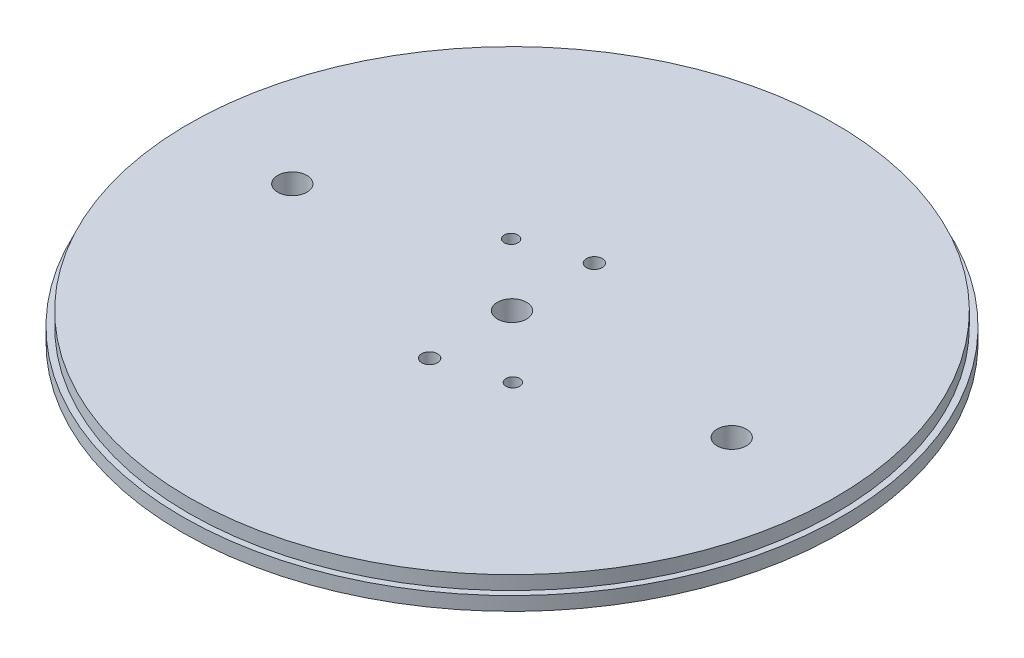
from build123d import *

# Parameters (mm, degrees)
SKETCH1_R                    = 76.2
BOSS_EXTRUDE1_DEPTH          = 1.5875
SKETCH2_R                    = 74.7776
BOSS_EXTRUDE2_DEPTH          = 3.175
SKETCH3_R                    = 3.3782
CUT_EXTRUDE1_DEPTH           = 108.95
F_27_0_144_DIAMETER_HOLE1_D  = 3.6576
F_1_8_0_125_DIAMETER_HOLE1_D = 3.175


with BuildPart() as part:
    # Sketch1 → Boss-Extrude1 (new, symmetric)
    with BuildSketch(Plane(origin=(0, 0, 0), x_dir=(1, 0, 0), z_dir=(0, 1, 0))):
        with Locations(Location((0, 0, 0), (0, 0, 270))):
            Circle(SKETCH1_R)
    extrude(amount=BOSS_EXTRUDE1_DEPTH, both=True)

    # Sketch2 → Boss-Extrude2 (add)
    with BuildSketch(Plane(origin=(0, 1.5875, 0), x_dir=(1, 0, 0), z_dir=(0, 1, 0))):
        with Locations(Location((0, 0, 0), (0, 0, 270))):
            Circle(SKETCH2_R)
    extrude(amount=BOSS_EXTRUDE2_DEPTH)

    # Sketch3 → Cut-Extrude1 (cut, through all)
    with BuildSketch(Plane.XZ.offset(1.5875)):
        with Locations(Location((50.8, 0, 0), (0, 0, 270))):
            Circle(SKETCH3_R)
        with Locations(Location((-50.8, 0, 0), (0, 0, 270))):
            Circle(SKETCH3_R)
        with Locations(Location((0, 0, 0), (0, 0, 270))):
            Circle(SKETCH3_R)
    extrude(amount=-CUT_EXTRUDE1_DEPTH, mode=Mode.SUBTRACT)

    # #27 (0.144) Diameter Hole1 (through all)
    with Locations(Plane(origin=(0, -1.5875, 0), x_dir=(-1, 0, 0), z_dir=(0, -1, 0))):
        with Locations((0, 19.05), (0, -19.05)):
            Hole(F_27_0_144_DIAMETER_HOLE1_D / 2)

    # 1/8 (0.125) Diameter Hole1 (through all)
    with Locations(Plane(origin=(0, -1.5875, 0), x_dir=(-1, 0, 0), z_dir=(0, -1, 0))):
        with Locations((14.469766177, 14.266333333), (-14.469766177, -14.266333333)):
            Hole(F_1_8_0_125_DIAMETER_HOLE1_D / 2)


solid = part.part
